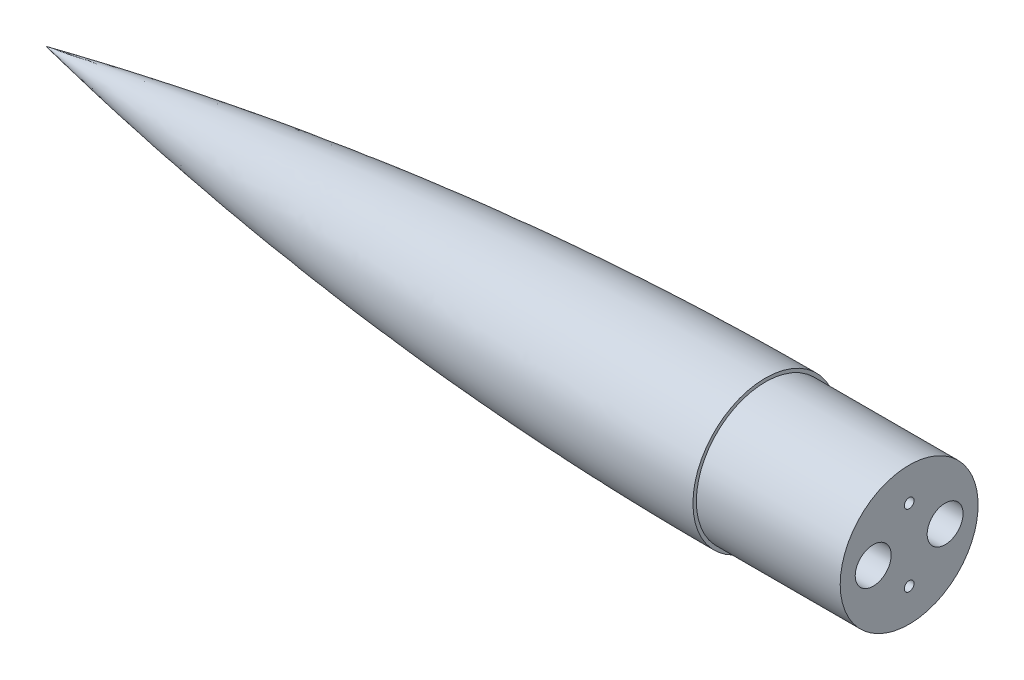
from build123d import *

# Parameters (mm, degrees)
SKETCH3_R           = 48.7045
BOSS_EXTRUDE1_DEPTH = 76.2
SKETCH4_R           = 12.7
SKETCH5_R           = 48.7045
SKETCH5_R_2         = 12.7
BOSS_EXTRUDE2_DEPTH = 25.4
SKETCH6_R           = 3.429
CUT_EXTRUDE1_DEPTH  = 355.6


with BuildPart() as part:
    # Sketch2 → Revolve1 (revolve)
    with BuildSketch(Plane.XY):
        with BuildLine():
            Line((-1e-09, 0), (508, 0))
            Line((508, 0), (508, 51.1048))
            add(Edge.make_bspline(
                [(-1e-09, 0), (0.711812873, 0.144680974), (2.158225426, 0.437865374), (5.390910998, 1.091290389), (8.4055347, 1.694324361), (12.023782781, 2.415194505), (15.32985135, 3.067757265), (18.81147443, 3.751148051), (22.194233026, 4.409589314), (25.653426609, 5.078524787), (29.101387687, 5.740045977), (33.459511631, 6.570152036), (38.703794572, 7.558802799), (44.830842505, 8.699211823), (51.833102117, 9.982239097), (58.840911875, 11.246114682), (65.851059887, 12.490186989), (72.865349703, 13.714824009), (79.882611918, 14.919789625), (86.903462237, 16.105210706), (93.927446457, 17.270996817), (100.95474067, 18.417185788), (109.742774093, 19.825383246), (120.294674252, 21.475961868), (146.693369586, 25.479624229), (189.013226456, 31.334973644), (234.983464044, 36.738785793), (281.060072425, 41.114345359), (312.999037596, 43.668169814), (330.752870377, 44.954816779), (344.961441701, 45.904815612), (359.175131847, 46.775466104), (371.61611191, 47.467831729), (382.282525687, 48.011662883), (391.172664946, 48.431765176), (398.285951755, 48.747990192), (405.399564609, 49.044355925), (412.514881745, 49.320860063), (421.408249235, 49.641660547), (430.30556766, 49.929351449), (439.199267742, 50.183928153), (448.100682593, 50.405386823), (455.212245734, 50.562681557), (462.343887521, 50.700102863), (468.551333113, 50.80295632), (473.924175337, 50.878694291), (479.17080941, 50.944021455), (484.543653599, 50.999186043), (490.444224468, 51.049296261), (496.881841793, 51.082598465), (501.585135763, 51.099249612), (505.808857653, 51.104007087), (507.273632283, 51.1048), (508, 51.1048)],
                knots=[0.083030368, 0.083030368, 0.083030368, 0.083030368, 0.083030368, 0.088711546, 0.094392725, 0.100073903, 0.105755081, 0.111436259, 0.117117438, 0.122798616, 0.128479794, 0.134286138, 0.140092482, 0.151705171, 0.163317859, 0.174930547, 0.186543236, 0.198155925, 0.209768614, 0.221381304, 0.232993993, 0.244606682, 0.256219371, 0.26783206, 0.291057438, 0.314282816, 0.430409703, 0.546536592, 0.592987348, 0.616212726, 0.639438104, 0.662663482, 0.685888859, 0.709114237, 0.720726926, 0.732339615, 0.743952304, 0.755564993, 0.767177681, 0.77879037, 0.802015748, 0.813628437, 0.825241126, 0.836853815, 0.848466503, 0.860079192, 0.865885537, 0.871691881, 0.883054237, 0.894416592, 0.905778948, 0.911460125, 0.917141303, 0.917141303, 0.917141303, 0.917141303, 0.917141303], degree=4))
        make_face()
    revolve(axis=Axis((-1e-09, 0, 0), (1, 0, 0)))

    # Sketch3 → Boss-Extrude1 (add)
    with BuildSketch(Plane(origin=(508, 0, 0), x_dir=(0, 0, -1), z_dir=(1, 0, 0))):
        with Locations(Location((0, 0, 0), (0, 0, 180))):
            Circle(SKETCH3_R)
    extrude(amount=BOSS_EXTRUDE1_DEPTH)

    # Sketch4 → Cut-Revolve1 (revolve, cut)
    with BuildSketch(Plane(origin=(584.2, 0, 0), x_dir=(0, 0, -1), z_dir=(1, 0, 0)), mode=Mode.PRIVATE) as cut_revolve1_sk:
        with Locations((-25.4, 0)):
            Circle(SKETCH4_R)
    revolve(cut_revolve1_sk.sketch.rotate(Axis((584.2, 48.7045, 0), (0, -1, 0)), 90), axis=Axis((584.2, 48.7045, 0), (0, -1, 0)), mode=Mode.SUBTRACT)

    # Sketch5 → Boss-Extrude2 (add)
    with BuildSketch(Plane(origin=(584.2, 0, 0), x_dir=(0, 0, -1), z_dir=(1, 0, 0))):
        with Locations(Location((0, 0, 0), (0, 0, 180))):
            Circle(SKETCH5_R)
        with Locations(Location((-25.4, 0, 0), (0, 0, 180))):
            Circle(SKETCH5_R_2, mode=Mode.SUBTRACT)
        with Locations((25.4, 0)):
            Circle(SKETCH5_R_2, mode=Mode.SUBTRACT)
    extrude(amount=BOSS_EXTRUDE2_DEPTH)

    # Sketch6 → Cut-Extrude1 (cut)
    with BuildSketch(Plane(origin=(609.6, 0, 0), x_dir=(0, 0, -1), z_dir=(1, 0, 0))):
        with Locations((0, 25.4)):
            Circle(SKETCH6_R)
        with Locations((0, -25.4)):
            Circle(SKETCH6_R)
    extrude(amount=-CUT_EXTRUDE1_DEPTH, mode=Mode.SUBTRACT)


solid = part.part
